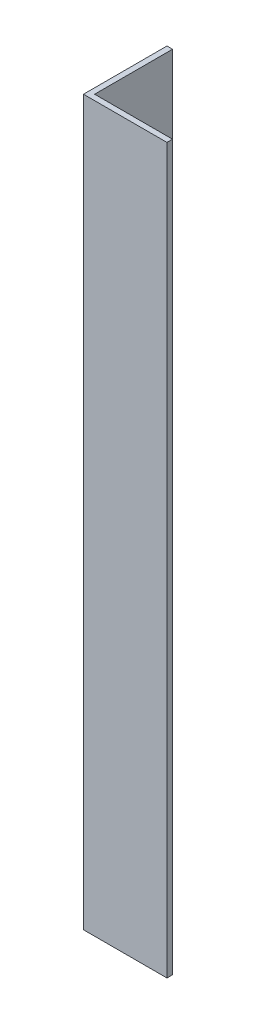
from build123d import *

# Parameters (mm, degrees)
SKETCH_1_W      = 15
SKETCH_1_H      = 1
EXTRUDE_1_DEPTH = 130
SKETCH_3_W      = 1
SKETCH_3_H      = 130
EXTRUDE_2_DEPTH = 14
M3X0_5_1_D      = 2.5


with BuildPart() as part:
    # ｽｹｯﾁ1 → ﾎﾞｽ - 押し出し1 (new body)
    with BuildSketch(Plane(origin=(0, 0, 0), x_dir=(1, 0, 0), z_dir=(0, 1, 0))):
        with Locations((7.5, -0.5)):
            Rectangle(SKETCH_1_W, SKETCH_1_H)
    extrude(amount=EXTRUDE_1_DEPTH)

    # ｽｹｯﾁ3 → ﾎﾞｽ - 押し出し2 (add)
    with BuildSketch(Plane(origin=(0, 0, 0), x_dir=(-1, 0, 0), z_dir=(0, 0, -1))):
        with Locations((-0.5, 65)):
            Rectangle(SKETCH_3_W, SKETCH_3_H)
    extrude(amount=EXTRUDE_2_DEPTH)

    # M3x0.5 ねじ穴1 (through all)
    with Locations(Plane.ZY):
        with Locations((-7, 15), (-7, 75)):
            Hole(M3X0_5_1_D / 2)


solid = part.part
